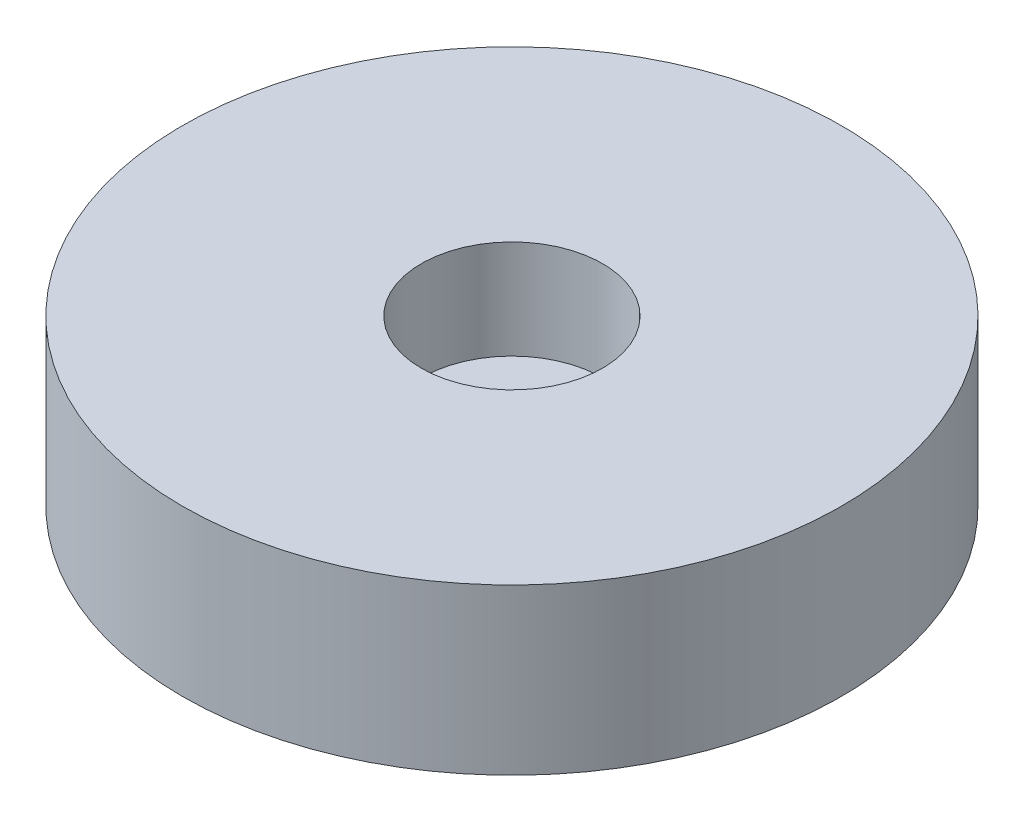
from build123d import *

# Parameters (mm, degrees)
SKETCH1_R           = 6
BOSS_EXTRUDE1_DEPTH = 3
SKETCH2_R           = 1.65
CUT_EXTRUDE1_DEPTH  = 1.8


with BuildPart() as part:
    # Sketch1 → Boss-Extrude1 (new body)
    with BuildSketch(Plane(origin=(0, 0, 0), x_dir=(1, 0, 0), z_dir=(0, 1, 0))):
        with Locations(Location((0, 0, 0), (0, 0, 270))):
            Circle(SKETCH1_R)
    extrude(amount=BOSS_EXTRUDE1_DEPTH)

    # Sketch2 → Cut-Extrude1 (cut)
    with BuildSketch(Plane(origin=(0, 3, 0), x_dir=(1, 0, 0), z_dir=(0, 1, 0))):
        with Locations(Location((0, 0, 0), (0, 0, 270))):
            Circle(SKETCH2_R)
    extrude(amount=-CUT_EXTRUDE1_DEPTH, mode=Mode.SUBTRACT)


solid = part.part
